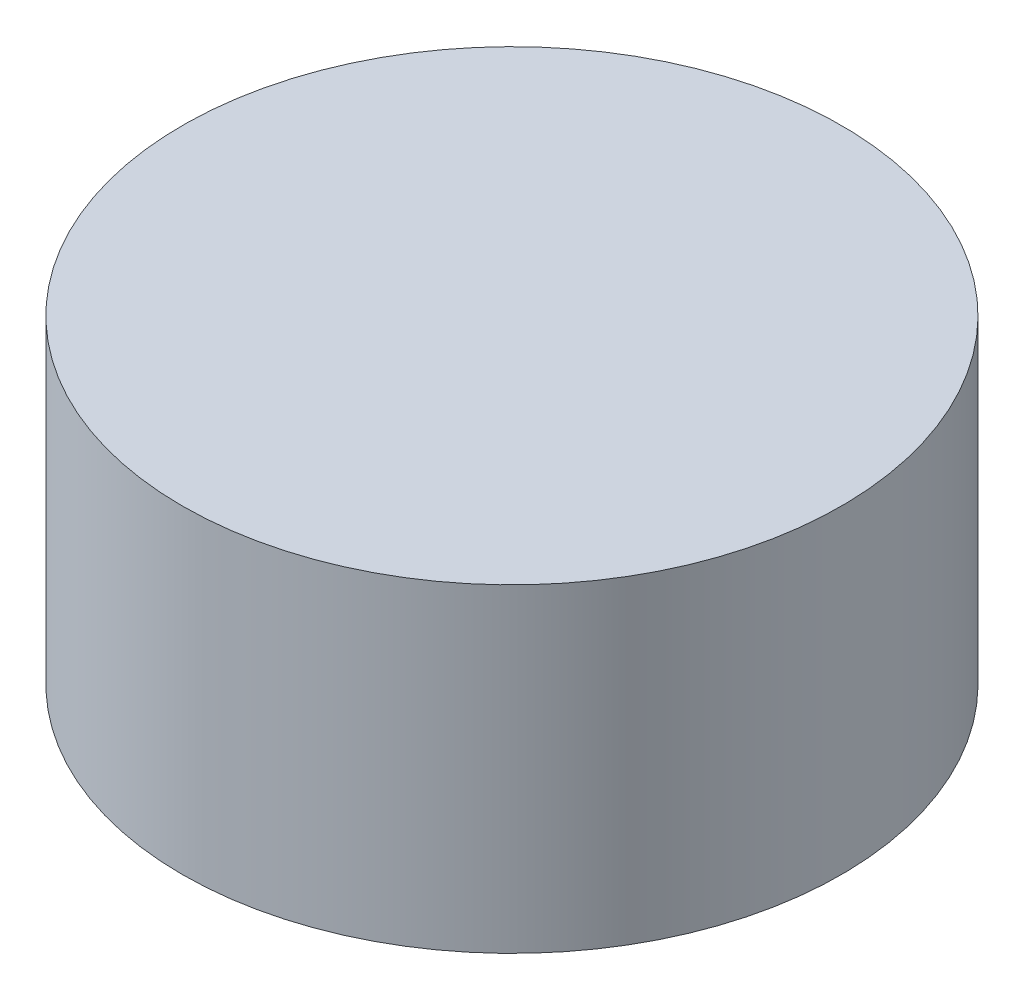
from build123d import *

# Parameters (mm, degrees)
SKETCH1_R           = 10.325
BOSS_EXTRUDE1_DEPTH = 10


with BuildPart() as part:
    # Sketch1 → Boss-Extrude1 (new body)
    with BuildSketch(Plane(origin=(0, 0, 0), x_dir=(1, 0, 0), z_dir=(0, 1, 0))):
        with Locations(Location((0, 0, 0), (0, 0, 270))):
            Circle(SKETCH1_R)
    extrude(amount=BOSS_EXTRUDE1_DEPTH)


solid = part.part
